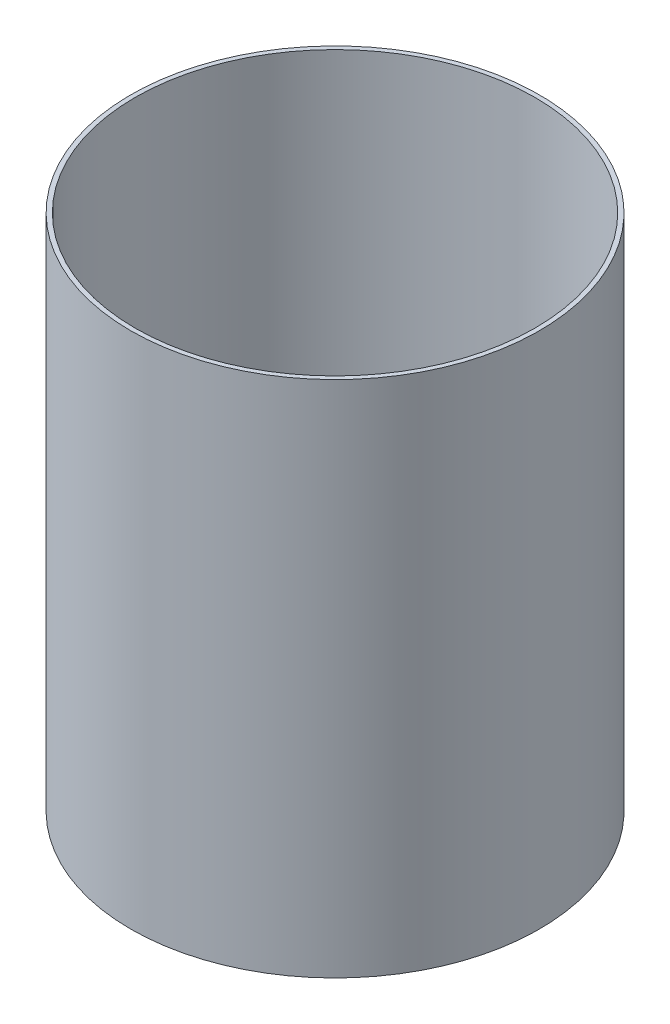
from build123d import *

# Parameters (mm, degrees)
SKETCH1_R               = 690
BOSS_EXTRUDE1_DEPTH     = 875
CUT_EXTRUDE1_DEPTH      = 1311.658231577
CUT_EXTRUDE1_DEPTH_BACK = 1311.658231577
SKETCH2_R               = 675


with BuildPart() as part:
    # Sketch1 → Boss-Extrude1 (new, symmetric)
    with BuildSketch(Plane(origin=(0, 0, 0), x_dir=(1, 0, 0), z_dir=(0, 1, 0))):
        with Locations(Location((0, 0, 0), (0, 0, 270))):
            Circle(SKETCH1_R)
    extrude(amount=BOSS_EXTRUDE1_DEPTH, both=True)

    # Sketch2 → Cut-Extrude1 (cut, two sides: drawn at the far end of the back side and taken through both)
    with BuildSketch(Plane(origin=(0, 0, 0), x_dir=(1, 0, 0), z_dir=(0, 1, 0)).offset(-CUT_EXTRUDE1_DEPTH_BACK)):
        with Locations(Location((0, 0, 0), (0, 0, 270))):
            Circle(SKETCH2_R)
    extrude(amount=CUT_EXTRUDE1_DEPTH + CUT_EXTRUDE1_DEPTH_BACK, mode=Mode.SUBTRACT)


solid = part.part
